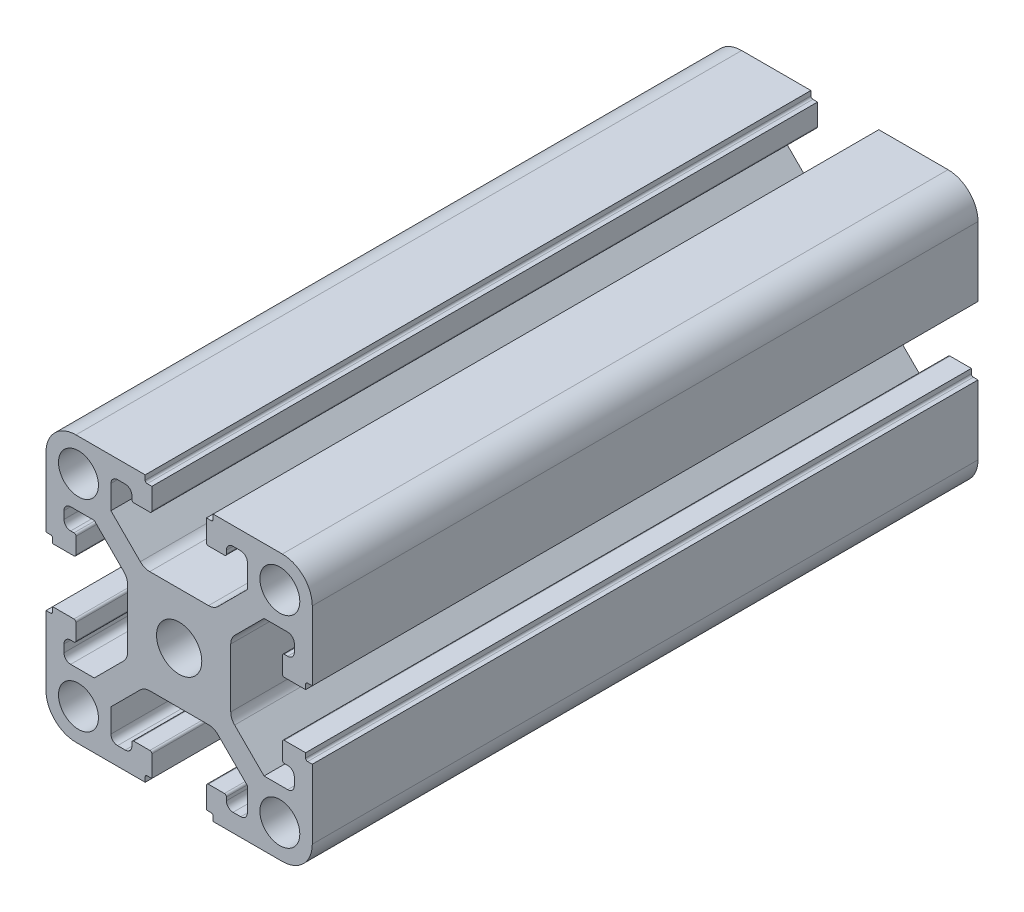
from build123d import *

# Parameters (mm, degrees)
SKETCH_1_R      = 3.4
SKETCH_1_R_2    = 3
EXTRUDE_1_DEPTH = 100


with BuildPart() as part:
    # 草图1 → 凸台-拉伸1 (new body)
    with BuildSketch(Plane.XY):
        with BuildLine():
            Line((-5.280003001, 19.242987377), (-15.680003001, 19.242987377))
            ThreePointArc((-15.680003001, 19.242987377), (-18.861983517, 17.924967893), (-20.180003001, 14.742987377))
            Line((-20.180003001, 14.742987377), (-20.180003001, 4.342987377))
            Line((-20.180003001, 4.342987377), (-19.480003001, 4.342987377))
            ThreePointArc((-19.480003001, 4.342987377), (-19.267870967, 4.255119412), (-19.180003001, 4.042987377))
            Line((-19.180003001, 4.042987377), (-19.180003001, 3.342987377))
            Line((-19.180003001, 3.342987377), (-15.980003001, 3.342987377))
            ThreePointArc((-15.980003001, 3.342987377), (-15.767870967, 3.430855343), (-15.680003001, 3.642987377))
            Line((-15.680003001, 3.642987377), (-15.680003001, 6.042987377))
            ThreePointArc((-15.680003001, 6.042987377), (-15.767870967, 6.255119412), (-15.980003001, 6.342987377))
            Line((-15.980003001, 6.342987377), (-16.480003001, 6.342987377))
            ThreePointArc((-16.480003001, 6.342987377), (-17.187109783, 6.635880596), (-17.480003001, 7.342987377))
            Line((-17.480003001, 7.342987377), (-17.480003001, 8.492987377))
            ThreePointArc((-17.480003001, 8.492987377), (-17.187109783, 9.200094158), (-16.480003001, 9.492987377))
            Line((-16.480003001, 9.492987377), (-12.933161007, 9.492987377))
            Line((-12.933161007, 9.492987377), (-8.515789439, 5.07561581))
            ThreePointArc((-8.515789439, 5.07561581), (-8.082243936, 4.426769112), (-7.930003001, 3.661402247))
            Line((-7.930003001, 3.661402247), (-7.930003001, -5.175427493))
            ThreePointArc((-7.930003001, -5.175427493), (-8.082243936, -5.940794357), (-8.515789439, -6.589641055))
            Line((-8.515789439, -6.589641055), (-12.933161007, -11.007012623))
            Line((-12.933161007, -11.007012623), (-16.480003001, -11.007012623))
            ThreePointArc((-16.480003001, -11.007012623), (-17.187109783, -10.714119404), (-17.480003001, -10.007012623))
            Line((-17.480003001, -10.007012623), (-17.480003001, -8.857012623))
            ThreePointArc((-17.480003001, -8.857012623), (-17.187109783, -8.149905842), (-16.480003001, -7.857012623))
            Line((-16.480003001, -7.857012623), (-15.980003001, -7.857012623))
            ThreePointArc((-15.980003001, -7.857012623), (-15.767870967, -7.769144657), (-15.680003001, -7.557012623))
            Line((-15.680003001, -7.557012623), (-15.680003001, -5.157012623))
            ThreePointArc((-15.680003001, -5.157012623), (-15.767870967, -4.944880588), (-15.980003001, -4.857012623))
            Line((-15.980003001, -4.857012623), (-19.180003001, -4.857012623))
            Line((-19.180003001, -4.857012623), (-19.180003001, -5.557012623))
            ThreePointArc((-19.180003001, -5.557012623), (-19.267870967, -5.769144657), (-19.480003001, -5.857012623))
            Line((-19.480003001, -5.857012623), (-20.180003001, -5.857012623))
            Line((-20.180003001, -5.857012623), (-20.180003001, -16.257012623))
            ThreePointArc((-20.180003001, -16.257012623), (-18.861983517, -19.438993138), (-15.680003001, -20.757012623))
            Line((-15.680003001, -20.757012623), (-5.280003001, -20.757012623))
            Line((-5.280003001, -20.757012623), (-5.280003001, -20.057012623))
            ThreePointArc((-5.280003001, -20.057012623), (-5.192135036, -19.844880588), (-4.980003001, -19.757012623))
            Line((-4.980003001, -19.757012623), (-4.280003001, -19.757012623))
            Line((-4.280003001, -19.757012623), (-4.280003001, -16.557012623))
            ThreePointArc((-4.280003001, -16.557012623), (-4.367870967, -16.344880588), (-4.580003001, -16.257012623))
            Line((-4.580003001, -16.257012623), (-6.980003001, -16.257012623))
            ThreePointArc((-6.980003001, -16.257012623), (-7.192135036, -16.344880588), (-7.280003001, -16.557012623))
            Line((-7.280003001, -16.557012623), (-7.280003001, -17.057012623))
            ThreePointArc((-7.280003001, -17.057012623), (-7.57289622, -17.764119404), (-8.280003001, -18.057012623))
            Line((-8.280003001, -18.057012623), (-9.430003001, -18.057012623))
            ThreePointArc((-9.430003001, -18.057012623), (-10.137109783, -17.764119404), (-10.430003001, -17.057012623))
            Line((-10.430003001, -17.057012623), (-10.430003001, -13.510170628))
            Line((-10.430003001, -13.510170628), (-6.012631434, -9.09279906))
            ThreePointArc((-6.012631434, -9.09279906), (-5.363784736, -8.659253558), (-4.598417871, -8.507012623))
            Line((-4.598417871, -8.507012623), (4.238411868, -8.507012623))
            ThreePointArc((4.238411868, -8.507012623), (5.003778733, -8.659253558), (5.652625431, -9.09279906))
            Line((5.652625431, -9.09279906), (10.069996999, -13.510170628))
            Line((10.069996999, -13.510170628), (10.069996999, -17.057012623))
            ThreePointArc((10.069996999, -17.057012623), (9.77710378, -17.764119404), (9.069996999, -18.057012623))
            Line((9.069996999, -18.057012623), (7.919996999, -18.057012623))
            ThreePointArc((7.919996999, -18.057012623), (7.212890217, -17.764119404), (6.919996999, -17.057012623))
            Line((6.919996999, -17.057012623), (6.919996999, -16.557012623))
            ThreePointArc((6.919996999, -16.557012623), (6.832129033, -16.344880588), (6.619996999, -16.257012623))
            Line((6.619996999, -16.257012623), (4.219996999, -16.257012623))
            ThreePointArc((4.219996999, -16.257012623), (4.007864964, -16.344880588), (3.919996999, -16.557012623))
            Line((3.919996999, -16.557012623), (3.919996999, -19.757012623))
            Line((3.919996999, -19.757012623), (4.619996999, -19.757012623))
            ThreePointArc((4.619996999, -19.757012623), (4.832129033, -19.844880588), (4.919996999, -20.057012623))
            Line((4.919996999, -20.057012623), (4.919996999, -20.757012623))
            Line((4.919996999, -20.757012623), (15.319996999, -20.757012623))
            ThreePointArc((15.319996999, -20.757012623), (18.501977514, -19.438993138), (19.819996999, -16.257012623))
            Line((19.819996999, -16.257012623), (19.819996999, -5.857012623))
            Line((19.819996999, -5.857012623), (19.119996999, -5.857012623))
            ThreePointArc((19.119996999, -5.857012623), (18.907864964, -5.769144657), (18.819996999, -5.557012623))
            Line((18.819996999, -5.557012623), (18.819996999, -4.857012623))
            Line((18.819996999, -4.857012623), (15.619996999, -4.857012623))
            ThreePointArc((15.619996999, -4.857012623), (15.407864964, -4.944880588), (15.319996999, -5.157012623))
            Line((15.319996999, -5.157012623), (15.319996999, -7.557012623))
            ThreePointArc((15.319996999, -7.557012623), (15.407864964, -7.769144657), (15.619996999, -7.857012623))
            Line((15.619996999, -7.857012623), (16.119996999, -7.857012623))
            ThreePointArc((16.119996999, -7.857012623), (16.82710378, -8.149905842), (17.119996999, -8.857012623))
            Line((17.119996999, -8.857012623), (17.119996999, -10.007012623))
            ThreePointArc((17.119996999, -10.007012623), (16.82710378, -10.714119404), (16.119996999, -11.007012623))
            Line((16.119996999, -11.007012623), (12.573155004, -11.007012623))
            Line((12.573155004, -11.007012623), (8.155783436, -6.589641055))
            ThreePointArc((8.155783436, -6.589641055), (7.722237934, -5.940794357), (7.569996999, -5.175427493))
            Line((7.569996999, -5.175427493), (7.569996999, 3.661402247))
            ThreePointArc((7.569996999, 3.661402247), (7.722237934, 4.426769112), (8.155783436, 5.07561581))
            Line((8.155783436, 5.07561581), (12.573155004, 9.492987377))
            Line((12.573155004, 9.492987377), (16.119996999, 9.492987377))
            ThreePointArc((16.119996999, 9.492987377), (16.82710378, 9.200094158), (17.119996999, 8.492987377))
            Line((17.119996999, 8.492987377), (17.119996999, 7.342987377))
            ThreePointArc((17.119996999, 7.342987377), (16.82710378, 6.635880596), (16.119996999, 6.342987377))
            Line((16.119996999, 6.342987377), (15.619996999, 6.342987377))
            ThreePointArc((15.619996999, 6.342987377), (15.407864964, 6.255119412), (15.319996999, 6.042987377))
            Line((15.319996999, 6.042987377), (15.319996999, 3.642987377))
            ThreePointArc((15.319996999, 3.642987377), (15.407864964, 3.430855343), (15.619996999, 3.342987377))
            Line((15.619996999, 3.342987377), (18.819996999, 3.342987377))
            Line((18.819996999, 3.342987377), (18.819996999, 4.042987377))
            ThreePointArc((18.819996999, 4.042987377), (18.907864964, 4.255119412), (19.119996999, 4.342987377))
            Line((19.119996999, 4.342987377), (19.819996999, 4.342987377))
            Line((19.819996999, 4.342987377), (19.819996999, 14.742987377))
            ThreePointArc((19.819996999, 14.742987377), (18.501977514, 17.924967893), (15.319996999, 19.242987377))
            Line((15.319996999, 19.242987377), (4.919996999, 19.242987377))
            Line((4.919996999, 19.242987377), (4.919996999, 18.542987377))
            ThreePointArc((4.919996999, 18.542987377), (4.832129033, 18.330855343), (4.619996999, 18.242987377))
            Line((4.619996999, 18.242987377), (3.919996999, 18.242987377))
            Line((3.919996999, 18.242987377), (3.919996999, 15.042987377))
            ThreePointArc((3.919996999, 15.042987377), (4.007864964, 14.830855343), (4.219996999, 14.742987377))
            Line((4.219996999, 14.742987377), (6.619996999, 14.742987377))
            ThreePointArc((6.619996999, 14.742987377), (6.832129033, 14.830855343), (6.919996999, 15.042987377))
            Line((6.919996999, 15.042987377), (6.919996999, 15.542987377))
            ThreePointArc((6.919996999, 15.542987377), (7.212890217, 16.250094158), (7.919996999, 16.542987377))
            Line((7.919996999, 16.542987377), (9.069996999, 16.542987377))
            ThreePointArc((9.069996999, 16.542987377), (9.77710378, 16.250094158), (10.069996999, 15.542987377))
            Line((10.069996999, 15.542987377), (10.069996999, 11.996145383))
            Line((10.069996999, 11.996145383), (5.652625431, 7.578773815))
            ThreePointArc((5.652625431, 7.578773815), (5.003778733, 7.145228312), (4.238411868, 6.992987377))
            Line((4.238411868, 6.992987377), (-4.598417871, 6.992987377))
            ThreePointArc((-4.598417871, 6.992987377), (-5.363784736, 7.145228312), (-6.012631434, 7.578773815))
            Line((-6.012631434, 7.578773815), (-10.430003001, 11.996145383))
            Line((-10.430003001, 11.996145383), (-10.430003001, 15.542987377))
            ThreePointArc((-10.430003001, 15.542987377), (-10.137109783, 16.250094158), (-9.430003001, 16.542987377))
            Line((-9.430003001, 16.542987377), (-8.280003001, 16.542987377))
            ThreePointArc((-8.280003001, 16.542987377), (-7.57289622, 16.250094158), (-7.280003001, 15.542987377))
            Line((-7.280003001, 15.542987377), (-7.280003001, 15.042987377))
            ThreePointArc((-7.280003001, 15.042987377), (-7.192135036, 14.830855343), (-6.980003001, 14.742987377))
            Line((-6.980003001, 14.742987377), (-4.580003001, 14.742987377))
            ThreePointArc((-4.580003001, 14.742987377), (-4.367870967, 14.830855343), (-4.280003001, 15.042987377))
            Line((-4.280003001, 15.042987377), (-4.280003001, 18.242987377))
            Line((-4.280003001, 18.242987377), (-4.980003001, 18.242987377))
            ThreePointArc((-4.980003001, 18.242987377), (-5.192135036, 18.330855343), (-5.280003001, 18.542987377))
            Line((-5.280003001, 18.542987377), (-5.280003001, 19.242987377))
        make_face()
        with Locations((-0.180003001, -0.757012623)):
            Circle(SKETCH_1_R, mode=Mode.SUBTRACT)
        with Locations((-15.305003001, 14.367987377)):
            Circle(SKETCH_1_R_2, mode=Mode.SUBTRACT)
        with Locations((14.944996999, 14.367987377)):
            Circle(SKETCH_1_R_2, mode=Mode.SUBTRACT)
        with Locations((-15.305003001, -15.882012623)):
            Circle(SKETCH_1_R_2, mode=Mode.SUBTRACT)
        with Locations((14.944996999, -15.882012623)):
            Circle(SKETCH_1_R_2, mode=Mode.SUBTRACT)
    extrude(amount=EXTRUDE_1_DEPTH)


solid = part.part
